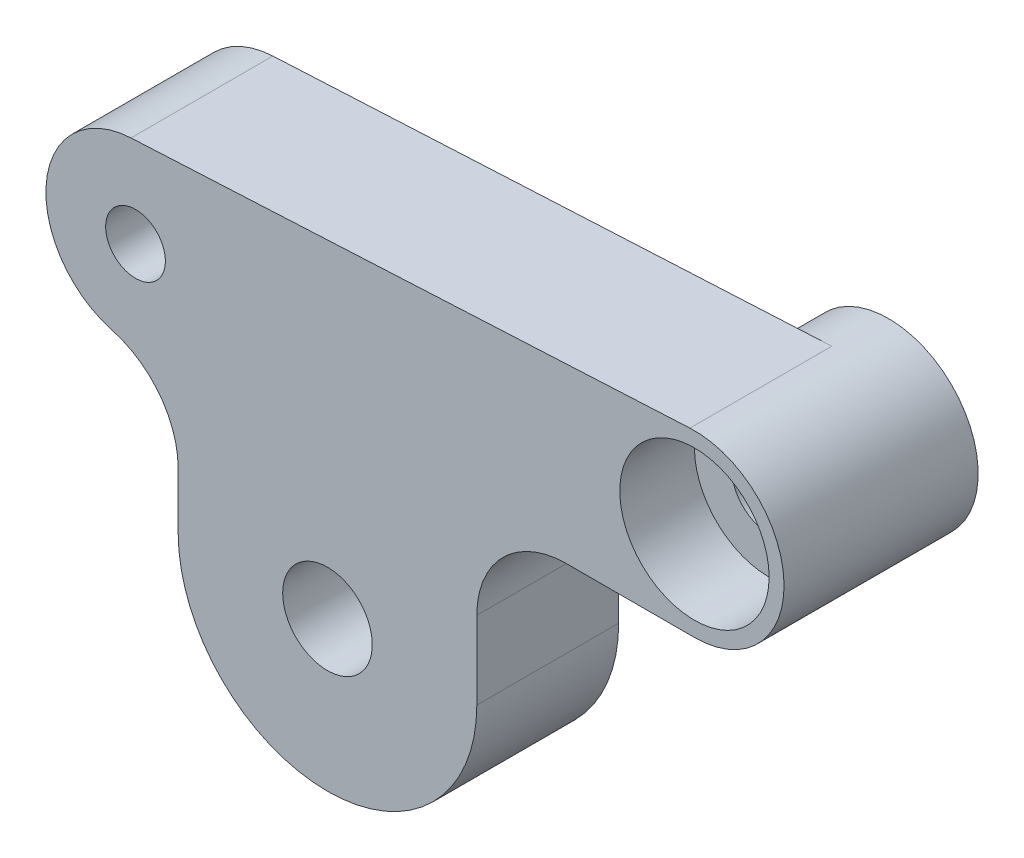
from build123d import *

# Parameters (mm, degrees)
EXTRUDE_1_DEPTH     = 9.5
SKETCH_2_R          = 3
CUT_EXTRUDE_1_DEPTH = 40.542790152
EXTRUDE_START       = 3.5
SKETCH_3_R          = 6
EXTRUDE_2_DEPTH     = 3.5
SKETCH_4_R          = 2.5
CUT_EXTRUDE_2_DEPTH = 41.526315562
SKETCH_5_R          = 5
CUT_EXTRUDE_3_DEPTH = 5
SKETCH_6_R          = 2
CUT_EXTRUDE_4_DEPTH = 40.542790152
SKETCH_8_R          = 4
CUT_EXTRUDE_5_DEPTH = 6
FILLET_1_R          = 6


with BuildPart() as part:
    # 草图1 → 凸台-拉伸1 (new body)
    with BuildSketch(Plane.XY):
        with BuildLine():
            Line((-10, 0), (-10, 9.320888862))
            Line((-10, 9.320888862), (-12.855752194, 9.320888862))
            ThreePointArc((-12.855752194, 9.320888862), (-18.853850562, 15.169839333), (-13.157755506, 21.313283542))
            Line((-13.157755506, 21.313283542), (24.272558016, 23.19968777))
            ThreePointArc((24.272558016, 23.19968777), (30.572659697, 17.35834262), (24.574561329, 11.207293091))
            Line((24.574561329, 11.207293091), (10, 11.207293091))
            Line((10, 11.207293091), (10, 0))
            ThreePointArc((10, 0), (0, -10), (-10, 0))
        make_face()
    extrude(amount=EXTRUDE_1_DEPTH)

    # 草图2 → 切除-拉伸1 (cut, through all)
    with BuildSketch(Plane(origin=(0, 0, 0), x_dir=(-1, 0, 0), z_dir=(0, 0, -1))):
        Circle(SKETCH_2_R)
    extrude(amount=-CUT_EXTRUDE_1_DEPTH, mode=Mode.SUBTRACT)

    # 草图3 → 凸台-拉伸2 (add)
    with BuildSketch(Plane(origin=(0, 0, 0), x_dir=(-1, 0, 0), z_dir=(0, 0, -1)).offset(EXTRUDE_START)):
        with Locations((-24.574561329, 17.207293091)):
            Circle(SKETCH_3_R)
    extrude(amount=-EXTRUDE_2_DEPTH)

    # 草图4 → 切除-拉伸2 (cut, through all)
    with BuildSketch(Plane(origin=(0, 0, -3.5), x_dir=(-1, 0, 0), z_dir=(0, 0, -1))):
        with Locations((-24.574561329, 17.207293091)):
            Circle(SKETCH_4_R)
    extrude(amount=-CUT_EXTRUDE_2_DEPTH, mode=Mode.SUBTRACT)

    # 草图5 → 切除-拉伸3 (cut)
    with BuildSketch(Plane.XY.offset(9.5)):
        with Locations((24.574561329, 17.207293091)):
            Circle(SKETCH_5_R)
    extrude(amount=-CUT_EXTRUDE_3_DEPTH, mode=Mode.SUBTRACT)

    # 草图6 → 切除-拉伸4 (cut, through all)
    with BuildSketch(Plane(origin=(0, 0, 0), x_dir=(-1, 0, 0), z_dir=(0, 0, -1))):
        with Locations((12.855752194, 15.320888862)):
            Circle(SKETCH_6_R)
    extrude(amount=-CUT_EXTRUDE_4_DEPTH, mode=Mode.SUBTRACT)

    # 草图8 → 切除-拉伸5 (cut)
    with BuildSketch(Plane(origin=(0, 0, 0), x_dir=(-1, 0, 0), z_dir=(0, 0, -1))):
        with Locations((12.855752194, 15.320888862)):
            Circle(SKETCH_8_R)
    extrude(amount=-CUT_EXTRUDE_5_DEPTH, mode=Mode.SUBTRACT)

    # 圆角1
    fillet_1_edges = [part.edges().sort_by_distance(p)[0] for p in [
        (-10, 9.320888862, 4.75),
        (10, 11.207293091, 4.75),
    ]]
    fillet(fillet_1_edges, radius=FILLET_1_R)


solid = part.part
